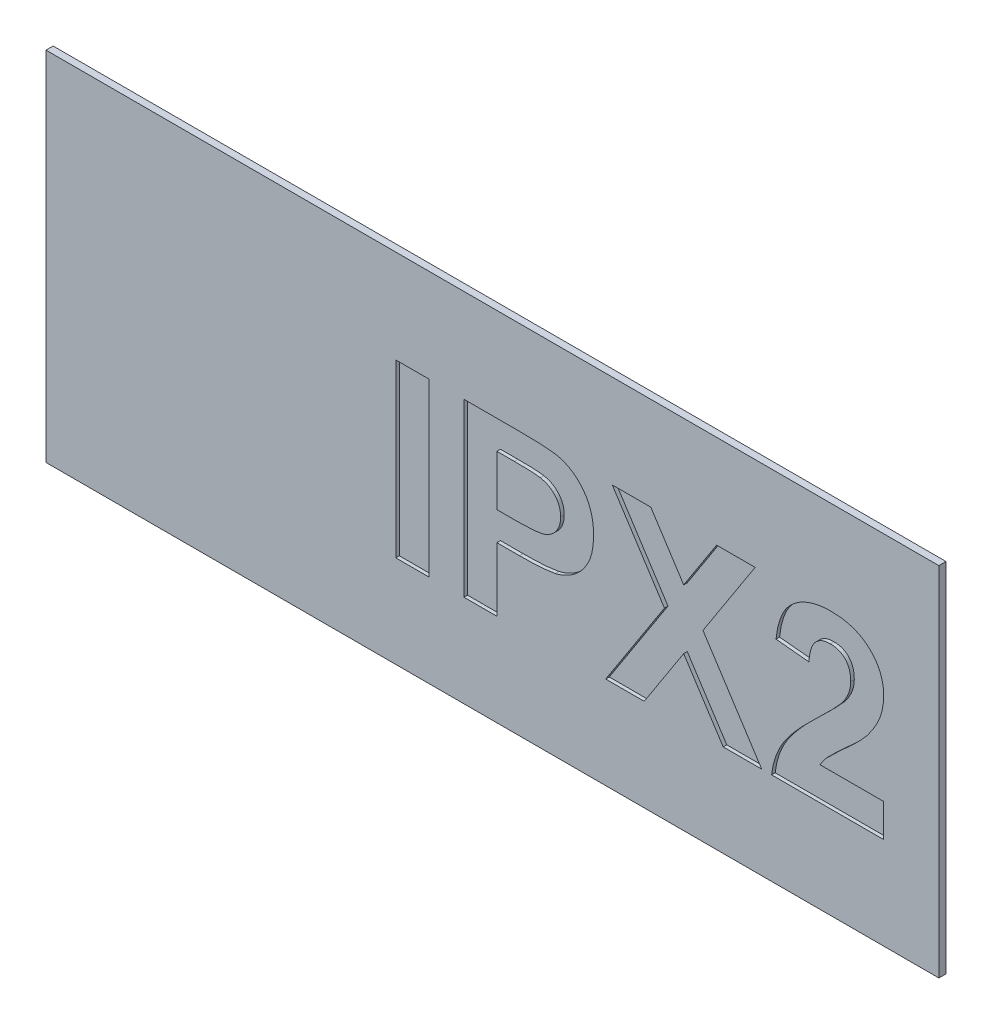
from build123d import *

# Parameters (mm, degrees)
SKETCH1_W           = 25
SKETCH1_H           = 10
BOSS_EXTRUDE1_DEPTH = 0.2
SKETCH2_W           = 0.923076923
SKETCH2_H           = 4.8
CUT_EXTRUDE1_DEPTH  = 0.1


with BuildPart() as part:
    # Sketch1 → Boss-Extrude1 (new body)
    with BuildSketch(Plane.XY):
        Rectangle(SKETCH1_W, SKETCH1_H)
    extrude(amount=BOSS_EXTRUDE1_DEPTH)

    # Sketch2 → Cut-Extrude1 (cut)
    # profile 1 of 4: a face of its own
    with BuildSketch(Plane.XY.offset(0.2)):
        with Locations((-2.244411501, -0.015241632)):
            Rectangle(SKETCH2_W, SKETCH2_H)
    # profile 2 of 4: a face of its own
    with BuildSketch(Plane.XY.offset(0.2)):
        with BuildLine():
            Line((-0.798257654, -2.415241632), (-0.798257654, 2.384758368))
            Line((-0.798257654, 2.384758368), (0.737319269, 2.384758368))
            add(Edge.make_bspline(
                [(0.737319269, 2.384758368), (0.806872824, 2.384682412), (0.939902268, 2.384537138), (1.129660722, 2.380500805), (1.300509782, 2.374786932), (1.452195879, 2.367670544), (1.585252756, 2.357051526), (1.699083537, 2.344754864), (1.794405005, 2.331526919), (1.850536994, 2.317837764), (1.875780807, 2.311681445)],
                knots=[0, 0, 0, 0, 1.460485487, 2.793352117, 3.985295279, 5.050041172, 5.981765236, 6.787433016, 7.454681457, 8, 8, 8, 8], degree=3))
            add(Edge.make_bspline(
                [(1.875780807, 2.311681445), (1.90934894, 2.302109877), (1.975973819, 2.283112556), (2.071426495, 2.242613286), (2.163427759, 2.195676794), (2.250821715, 2.139736978), (2.333905442, 2.075786969), (2.412925902, 2.004348288), (2.488304501, 1.925098444), (2.558998473, 1.838193992), (2.623745835, 1.744073149), (2.679703823, 1.642596759), (2.726584917, 1.534205891), (2.76652683, 1.419715089), (2.795996164, 1.297896825), (2.81661934, 1.169597507), (2.830975644, 1.034761019), (2.831992115, 0.942489924), (2.832511577, 0.895335291)],
                knots=[0, 0, 0, 0, 0.907145743, 1.80047177, 2.69161667, 3.591261238, 4.495029544, 5.415863088, 6.359363025, 7.337192411, 8.326890979, 9.326929023, 10.346104993, 11.395420813, 12.477187422, 13.601053412, 14.774031606, 16, 16, 16, 16], degree=3))
            add(Edge.make_bspline(
                [(2.832511577, 0.895335291), (2.831030074, 0.82372562), (2.828178101, 0.68587307), (2.796269582, 0.488244732), (2.747601242, 0.307723985), (2.676468945, 0.146049619), (2.589743899, 0.002587197), (2.494214475, -0.126743499), (2.385133912, -0.238044311), (2.267281986, -0.333111429), (2.142734039, -0.410910414), (2.017960635, -0.477232945), (1.891278139, -0.528223825), (1.804906295, -0.550440962), (1.762319269, -0.561395478)],
                knots=[0, 0, 0, 0, 1.312386234, 2.526415563, 3.661883817, 4.733421185, 5.753802465, 6.732107337, 7.675884281, 8.604170108, 9.50284679, 10.365392406, 11.194030444, 12, 12, 12, 12], degree=3))
            add(Edge.make_bspline(
                [(1.762319269, -0.561395478), (1.731922738, -0.567177613), (1.667850478, -0.579365662), (1.566235707, -0.591514929), (1.455165255, -0.604962844), (1.334182281, -0.613734329), (1.203433144, -0.621948457), (1.062968615, -0.625826618), (0.912989431, -0.630499015), (0.809759796, -0.630582972), (0.756550038, -0.630626247)],
                knots=[0, 0, 0, 0, 0.735353946, 1.55003838, 2.431865514, 3.394945452, 4.432993119, 5.54609699, 6.735134699, 8, 8, 8, 8], degree=3))
            Line((0.756550038, -0.630626247), (0.124819269, -0.630626247))
            Line((0.124819269, -0.630626247), (0.124819269, -2.415241632))
            Line((0.124819269, -2.415241632), (-0.798257654, -2.415241632))
        make_face()
        with BuildLine():
            Line((0.124819269, 1.584758368), (0.124819269, 0.169373753))
            Line((0.124819269, 0.169373753), (0.678665423, 0.169373753))
            add(Edge.make_bspline(
                [(0.678665423, 0.169373753), (0.726426028, 0.169435598), (0.817798074, 0.169553918), (0.948896691, 0.173800879), (1.067567284, 0.178985083), (1.174057811, 0.187566001), (1.267725465, 0.198875446), (1.349197518, 0.212402966), (1.418568922, 0.226919409), (1.493584651, 0.25097548), (1.573791463, 0.289896011), (1.659442913, 0.345834589), (1.73468761, 0.412715757), (1.797301172, 0.491265373), (1.847315545, 0.578538546), (1.883125873, 0.673640874), (1.906248568, 0.774996178), (1.908360615, 0.845207624), (1.909434654, 0.880912214)],
                knots=[0, 0, 0, 0, 1.411705958, 2.700771114, 3.876961699, 4.922619712, 5.858038221, 6.66485904, 7.363650596, 7.950905807, 8.989198271, 9.987739806, 10.967313358, 11.951275539, 12.944273208, 13.927870418, 14.946261014, 16, 16, 16, 16], degree=3))
            add(Edge.make_bspline(
                [(1.909434654, 0.880912214), (1.907923062, 0.924399848), (1.904992286, 1.008716635), (1.872674008, 1.128797813), (1.822810598, 1.237772937), (1.751520078, 1.3322513), (1.665402808, 1.411699834), (1.56861059, 1.477803839), (1.459076384, 1.524063925), (1.381555525, 1.541988001), (1.342126961, 1.551104522)],
                knots=[0, 0, 0, 0, 1.085904563, 2.105425768, 3.088705091, 4.068969419, 5.045188284, 6.010769642, 6.988240112, 8, 8, 8, 8], degree=3))
            add(Edge.make_bspline(
                [(1.342126961, 1.551104522), (1.325159949, 1.553818257), (1.287498444, 1.559841908), (1.224897357, 1.566128336), (1.150840262, 1.571845837), (1.065237889, 1.576540076), (0.968429546, 1.580209883), (0.860095914, 1.58342554), (0.74052231, 1.583683875), (0.656869768, 1.58439028), (0.613280807, 1.584758368)],
                knots=[0, 0, 0, 0, 0.564603001, 1.253243608, 2.066786758, 3.005752288, 4.070476343, 5.250658742, 6.567396469, 8, 8, 8, 8], degree=3))
            Line((0.613280807, 1.584758368), (0.124819269, 1.584758368))
        make_face(mode=Mode.SUBTRACT)
    # profile 3 of 4: a face of its own
    with BuildSketch(Plane.XY.offset(0.2)):
        Polygon((3.170973115, -2.415241632), (4.816165423, 0.12706606), (3.3555885, 2.384758368), (4.434434654, 2.384758368), (5.3555885, 0.960719906), (6.276742346, 2.384758368), (7.3555885, 2.384758368), (5.895011577, 0.12706606), (7.540203884, -2.415241632), (6.46135773, -2.415241632), (5.3555885, -0.706587786), (4.249819269, -2.415241632), align=None)
    # profile 4 of 4: a face of its own
    with BuildSketch(Plane.XY.offset(0.2)):
        with BuildLine():
            Line((10.9555885, -1.492164709), (10.9555885, -2.415241632))
            Line((10.9555885, -2.415241632), (7.817126961, -2.415241632))
            add(Edge.make_bspline(
                [(7.817126961, -2.415241632), (7.827753065, -2.336351316), (7.848999314, -2.178614919), (7.91468512, -1.948201744), (8.002353171, -1.723357854), (8.097500189, -1.540389503), (8.192134438, -1.393106276), (8.277996096, -1.272421263), (8.380425902, -1.144017588), (8.497937489, -1.006858679), (8.629881438, -0.86051578), (8.777242138, -0.705532962), (8.940722521, -0.542652172), (9.055733882, -0.432048101), (9.115203884, -0.374857017)],
                knots=[0, 0, 0, 0, 1.156289446, 2.311930546, 3.473459201, 4.661751613, 5.303057008, 6.018253237, 6.81459331, 7.690699809, 8.644447906, 9.679642995, 10.800191253, 12, 12, 12, 12], degree=3))
            add(Edge.make_bspline(
                [(9.115203884, -0.374857017), (9.162661627, -0.329047303), (9.25300719, -0.241839099), (9.381659449, -0.116960486), (9.49475804, -0.002161545), (9.594667701, 0.099582791), (9.679080375, 0.190863191), (9.749106435, 0.27024611), (9.805632752, 0.33805482), (9.836247454, 0.381072708), (9.849819269, 0.400142983)],
                knots=[0, 0, 0, 0, 1.480720495, 2.818855715, 4.024636094, 5.098235712, 6.019786162, 6.815086302, 7.474715479, 8, 8, 8, 8], degree=3))
            add(Edge.make_bspline(
                [(9.849819269, 0.400142983), (9.877611033, 0.446308072), (9.931218126, 0.53535518), (9.99000275, 0.675383368), (10.025287473, 0.815382631), (10.030129492, 0.908929337), (10.032511577, 0.954950676)],
                knots=[0, 0, 0, 0, 1.0911822, 2.104764037, 3.067617678, 4, 4, 4, 4], degree=3))
            add(Edge.make_bspline(
                [(10.032511577, 0.954950676), (10.030782777, 1.002842066), (10.027512022, 1.09344884), (10.000086181, 1.221311753), (9.951450902, 1.331228041), (9.884489072, 1.423535093), (9.799815705, 1.495857314), (9.700830076, 1.549296416), (9.586083195, 1.578841274), (9.505432318, 1.582727345), (9.463280807, 1.584758368)],
                knots=[0, 0, 0, 0, 1.193122327, 2.257294386, 3.237245624, 4.168877528, 5.075331632, 5.990371598, 6.949684428, 8, 8, 8, 8], degree=3))
            add(Edge.make_bspline(
                [(9.463280807, 1.584758368), (9.421414069, 1.582861545), (9.34053657, 1.579197291), (9.225592095, 1.547186877), (9.125036894, 1.491773483), (9.05337591, 1.428624575), (9.004965516, 1.367216849), (8.971980362, 1.31370406), (8.943549735, 1.252897122), (8.918357827, 1.185480619), (8.898459068, 1.110682223), (8.882433843, 1.0290716), (8.86951983, 0.94020957), (8.865412946, 0.878390798), (8.863280807, 0.846296829)],
                knots=[0, 0, 0, 0, 1.402788338, 2.709884207, 3.961032948, 5.225417836, 5.883680772, 6.578928686, 7.329201998, 8.132101139, 8.990263233, 9.922304639, 10.921339128, 12, 12, 12, 12], degree=3))
            Line((8.863280807, 0.846296829), (7.940203884, 0.936681445))
            add(Edge.make_bspline(
                [(7.940203884, 0.936681445), (7.94762528, 0.999000772), (7.96201418, 1.11982799), (7.997921921, 1.293377536), (8.043397745, 1.453484825), (8.100609637, 1.599852729), (8.167192961, 1.733412005), (8.24654402, 1.852158512), (8.335890203, 1.957407626), (8.435308726, 2.049103332), (8.544167554, 2.127537337), (8.658395361, 2.197551722), (8.780224478, 2.254985774), (8.908313561, 2.302320063), (9.042604726, 2.340149248), (9.183719088, 2.365161392), (9.33078574, 2.38275503), (9.431174051, 2.384080524), (9.482511577, 2.384758368)],
                knots=[0, 0, 0, 0, 1.270971563, 2.464210789, 3.586263665, 4.638946707, 5.643716971, 6.603612468, 7.52484387, 8.434700188, 9.336036235, 10.239171475, 11.145359471, 12.059630629, 13.003312604, 13.96741569, 14.960557767, 16, 16, 16, 16], degree=3))
            add(Edge.make_bspline(
                [(9.482511577, 2.384758368), (9.5383221, 2.383685719), (9.647020101, 2.3815966), (9.805699887, 2.364344637), (9.954768144, 2.334263341), (10.095528133, 2.294416407), (10.226534323, 2.241217837), (10.348878384, 2.176902977), (10.460634835, 2.09903095), (10.563469558, 2.011848446), (10.655395572, 1.915975961), (10.735914442, 1.813711747), (10.803372887, 1.70512705), (10.859980881, 1.5915454), (10.902011935, 1.471139101), (10.932637588, 1.345573044), (10.95294363, 1.214261436), (10.954697126, 1.124578586), (10.9555885, 1.078989137)],
                knots=[0, 0, 0, 0, 1.210756838, 2.35810096, 3.457354827, 4.507168606, 5.527358126, 6.519769748, 7.499700793, 8.476517721, 9.440526811, 10.376769937, 11.295256217, 12.209626307, 13.124630862, 14.055668209, 15.011616881, 16, 16, 16, 16], degree=3))
            add(Edge.make_bspline(
                [(10.9555885, 1.078989137), (10.954414127, 1.026666934), (10.952084351, 0.922867713), (10.929778476, 0.769421454), (10.895699443, 0.619513646), (10.845333315, 0.472777928), (10.781490337, 0.325694452), (10.699195208, 0.177933075), (10.60364434, 0.025037576), (10.528831776, -0.073816036), (10.490203884, -0.124857017)],
                knots=[0, 0, 0, 0, 0.953409949, 1.89141903, 2.821310783, 3.752688675, 4.715703262, 5.740811754, 6.833515735, 8, 8, 8, 8], degree=3))
            add(Edge.make_bspline(
                [(10.490203884, -0.124857017), (10.475604237, -0.143245315), (10.444335177, -0.182628789), (10.391138289, -0.243017256), (10.329487671, -0.308980498), (10.260254111, -0.381753196), (10.181150689, -0.458758268), (10.09502355, -0.543216008), (9.99808285, -0.630806122), (9.897675776, -0.723713556), (9.796832264, -0.814139056), (9.704142538, -0.900023233), (9.619949425, -0.976012284), (9.548173955, -1.046301153), (9.484594315, -1.106092675), (9.431502124, -1.15845289), (9.387903903, -1.2021142), (9.327828359, -1.270171105), (9.251389048, -1.362218097), (9.197610867, -1.450171602), (9.171934654, -1.492164709)],
                knots=[0, 0, 0, 0, 0.665555651, 1.425465941, 2.280616993, 3.225313414, 4.272635571, 5.410053715, 6.644756443, 7.976022804, 9.288331007, 10.484517221, 11.558462543, 12.503158964, 13.33222979, 14.032602617, 14.617328242, 15.080653724, 16.606167857, 18, 18, 18, 18], degree=3))
            Line((9.171934654, -1.492164709), (10.9555885, -1.492164709))
        make_face()
    extrude(amount=-CUT_EXTRUDE1_DEPTH, mode=Mode.SUBTRACT)


solid = part.part
